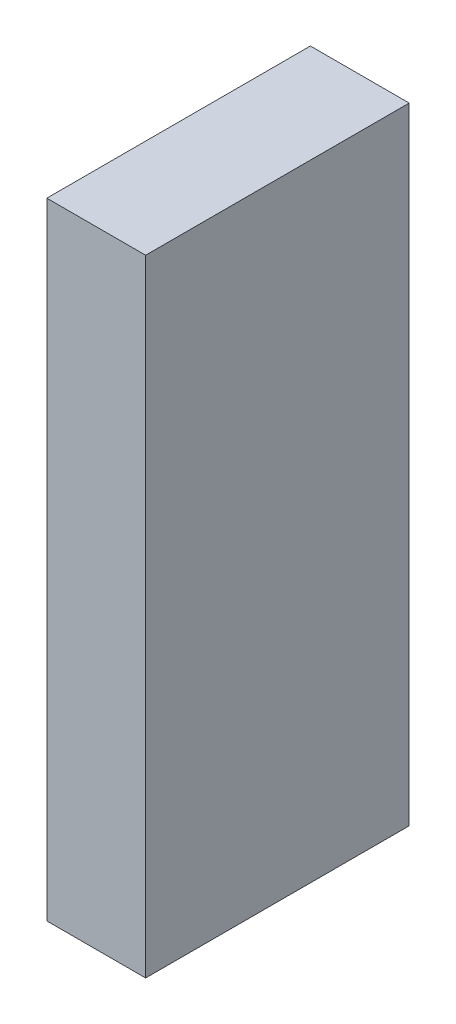
from build123d import *

# Parameters (mm, degrees)
SKETCH1_W           = 40
SKETCH1_H           = 95
BOSS_EXTRUDE1_DEPTH = 15


with BuildPart() as part:
    # Sketch1 → Boss-Extrude1 (new body)
    with BuildSketch(Plane(origin=(0, 0, 0), x_dir=(0, 0, -1), z_dir=(1, 0, 0))):
        with Locations((-0.129032258, -19.241935484)):
            Rectangle(SKETCH1_W, SKETCH1_H)
    extrude(amount=BOSS_EXTRUDE1_DEPTH)


solid = part.part
